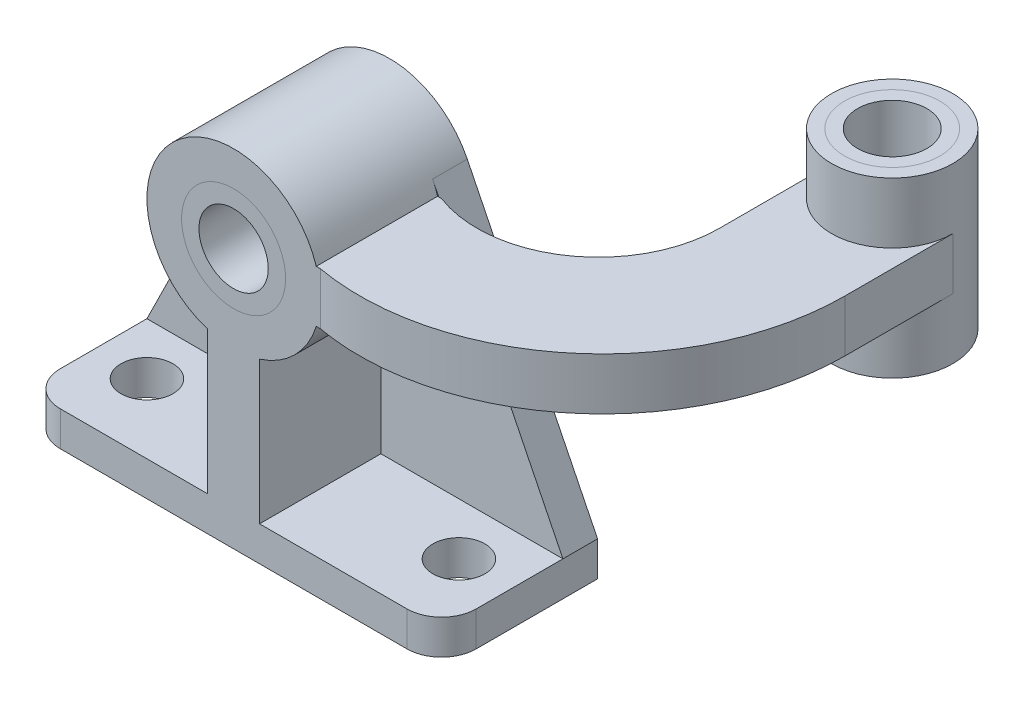
from build123d import *

# Parameters (mm, degrees)
BOSS_EXTRUDE1_DEPTH   = 2
BOSS_EXTRUDE1_2_DEPTH = 2
BOSS_EXTRUDE2_DEPTH   = 9
BOSS_EXTRUDE3_DEPTH   = 9
SKETCH2_R             = 1.5
CUT_EXTRUDE1_DEPTH    = 2
SKETCH4_W             = 1.262081145
SKETCH4_H             = 7
BOSS_EXTRUDE4_DEPTH   = 1.5
SKETCH4_4_R           = 3.5
SKETCH4_4_R_2         = 2.75
BOSS_EXTRUDE5_DEPTH   = 5
SKETCH4_5_R           = 2.75
SKETCH4_5_R_2         = 2
BOSS_EXTRUDE6_DEPTH   = 5
FILLET1_R             = 2


with BuildPart() as part:
    # Sketch1 → Boss-Extrude1 (new body)
    with BuildSketch(Plane.XY):
        with BuildLine():
            Line((1.5, -13), (12, -13))
            Line((12, -13), (4.482704724, 2.214804361))
            ThreePointArc((4.482704724, 2.214804361), (4.868959007, 1.137206309), (5, 0))
            ThreePointArc((5, 0), (4.031128874, -2.958039892), (1.5, -4.769696007))
            Line((1.5, -4.769696007), (1.5, -13))
        make_face()
    extrude(amount=BOSS_EXTRUDE1_DEPTH)



with BuildPart() as body_2:
    # Sketch1 → Boss-Extrude1 2 (new body)
    with BuildSketch(Plane.XY):
        with BuildLine():
            Line((-4.482704724, 2.214804361), (-12, -13))
            Line((-12, -13), (-1.5, -13))
            Line((-1.5, -13), (-1.5, -4.769696007))
            ThreePointArc((-1.5, -4.769696007), (-4.598260573, -1.963669957), (-4.482704724, 2.214804361))
        make_face()
    extrude(amount=BOSS_EXTRUDE1_2_DEPTH)


with BuildPart() as part_1:
    add(part.part)

    add(body_2.part)  # Boss-Extrude2 merges body 2
    # Sketch1<3> → Boss-Extrude2 (add)
    with BuildSketch(Plane.XY):
        Polygon((12, -15), (12, -13), (1.5, -13), (0, -13), (0, -15), align=None)
        Polygon((-1.5, -13), (-12, -13), (-12, -15), (0, -15), (0, -13), align=None)
        with BuildLine():
            ThreePointArc((4.482704724, 2.214804361), (2.638747638, 4.247000224), (0, 5))
            Line((0, 5), (0, 3))
            ThreePointArc((0, 3), (2.121320344, 2.121320344), (3, 0))
            ThreePointArc((3, 0), (2.121320344, -2.121320344), (0, -3))
            Line((0, -3), (0, -5))
            ThreePointArc((0, -5), (0.758788496, -4.942088629), (1.5, -4.769696007))
            ThreePointArc((1.5, -4.769696007), (4.031128874, -2.958039892), (5, 0))
            ThreePointArc((5, 0), (4.868959007, 1.137206309), (4.482704724, 2.214804361))
        make_face()
        with BuildLine():
            Line((0, 3), (0, 5))
            ThreePointArc((0, 5), (-2.638747638, 4.247000224), (-4.482704724, 2.214804361))
            ThreePointArc((-4.482704724, 2.214804361), (-4.598260573, -1.963669957), (-1.5, -4.769696007))
            ThreePointArc((-1.5, -4.769696007), (-0.758788496, -4.942088629), (0, -5))
            Line((0, -5), (0, -3))
            ThreePointArc((0, -3), (-3, 0), (0, 3))
        make_face()
        with BuildLine():
            ThreePointArc((1.5, -4.769696007), (0.758788496, -4.942088629), (0, -5))
            Line((0, -5), (0, -13))
            Line((0, -13), (1.5, -13))
            Line((1.5, -13), (1.5, -4.769696007))
        make_face()
        with BuildLine():
            ThreePointArc((0, -5), (-0.758788496, -4.942088629), (-1.5, -4.769696007))
            Line((-1.5, -4.769696007), (-1.5, -13))
            Line((-1.5, -13), (0, -13))
            Line((0, -13), (0, -5))
        make_face()
    extrude(amount=BOSS_EXTRUDE2_DEPTH)

    # Sketch2 → Cut-Extrude1 (cut)
    with BuildSketch(Plane(origin=(0, -13, 0), x_dir=(1, 0, 0), z_dir=(0, 1, 0))):
        with Locations(Location((9, -5, 0), (0, 0, 180))):
            Circle(SKETCH2_R)
        with Locations(Location((-9, -5, 0), (0, 0, 180))):
            Circle(SKETCH2_R)
    extrude(amount=-CUT_EXTRUDE1_DEPTH, mode=Mode.SUBTRACT)

    # Sketch4 → Boss-Extrude4 (add, symmetric)
    with BuildSketch(Plane(origin=(0, 0, 0), x_dir=(1, 0, 0), z_dir=(0, 1, 0))):
        with BuildLine():
            ThreePointArc((21.5, 11), (18, 7.5), (14.5, 11))
            Line((14.5, 11), (14.5, 4.538348415))
            ThreePointArc((14.5, 4.538348415), (11.468626967, -1.227932882), (5, -2))
            Line((5, -2), (5, -9))
            ThreePointArc((5, -9), (16.472179222, -5.972115316), (21.5, 4.774977314))
            Line((21.5, 4.774977314), (21.5, 11))
        make_face()
        with Locations((4.368959428, -5.5)):
            Rectangle(SKETCH4_W, SKETCH4_H)
    extrude(amount=BOSS_EXTRUDE4_DEPTH, both=True)

    # Sketch4<4> → Boss-Extrude5 (add, symmetric)
    with BuildSketch(Plane(origin=(0, 0, 0), x_dir=(1, 0, 0), z_dir=(0, 1, 0))):
        with Locations(Location((18, 11, 0), (0, 0, 270))):
            Circle(SKETCH4_4_R)
        with Locations(Location((18, 11, 0), (0, 0, 270))):
            Circle(SKETCH4_4_R_2, mode=Mode.SUBTRACT)
    extrude(amount=BOSS_EXTRUDE5_DEPTH, both=True)

    # Fillet1
    fillet1_edges = [part_1.edges().sort_by_distance(p)[0] for p in [
        (-12, -14, 9),
        (12, -14, 9),
    ]]
    fillet(fillet1_edges, radius=FILLET1_R)


with BuildPart() as body_2_2:
    # Sketch1<4> → Boss-Extrude3 (new body)
    with BuildSketch(Plane.XY):
        with BuildLine():
            ThreePointArc((3, 0), (2.121320344, 2.121320344), (0, 3))
            Line((0, 3), (0, 2))
            ThreePointArc((0, 2), (1.414213562, 1.414213562), (2, 0))
            ThreePointArc((2, 0), (1.414213562, -1.414213562), (0, -2))
            Line((0, -2), (0, -3))
            ThreePointArc((0, -3), (2.121320344, -2.121320344), (3, 0))
        make_face()
        with BuildLine():
            Line((0, 2), (0, 3))
            ThreePointArc((0, 3), (-3, 0), (0, -3))
            Line((0, -3), (0, -2))
            ThreePointArc((0, -2), (-2, 0), (0, 2))
        make_face()
    extrude(amount=BOSS_EXTRUDE3_DEPTH)


with BuildPart() as body_3:
    # Sketch4<5> → Boss-Extrude6 (new, symmetric)
    with BuildSketch(Plane(origin=(0, 0, 0), x_dir=(1, 0, 0), z_dir=(0, 1, 0))):
        with Locations(Location((18, 11, 0), (0, 0, 270))):
            Circle(SKETCH4_5_R)
        with Locations(Location((18, 11, 0), (0, 0, 270))):
            Circle(SKETCH4_5_R_2, mode=Mode.SUBTRACT)
    extrude(amount=BOSS_EXTRUDE6_DEPTH, both=True)


solid = Compound([part_1.part, body_2_2.part, body_3.part])
